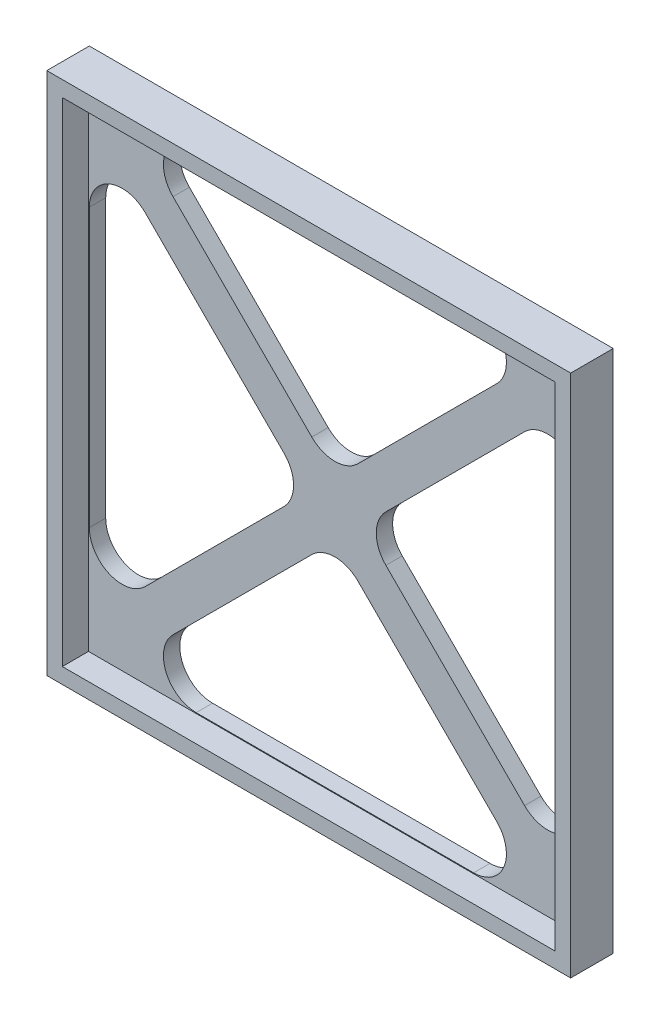
from build123d import *

# Parameters (mm, degrees)
SKETCH2_W           = 160
SKETCH2_H           = 160
BOSS_EXTRUDE1_DEPTH = 5
CUT_EXTRUDE1_REACH  = 115.248
SKETCH3_W           = 150
SKETCH3_H           = 150
BOSS_EXTRUDE2_DEPTH = 5
SKETCH5_W           = 160
SKETCH5_H           = 160
SKETCH5_W_2         = 150.5
SKETCH5_H_2         = 150.5
BOSS_EXTRUDE3_DEPTH = 8
FILLET1_R           = 10


with BuildPart() as part:
    # Sketch2 → Boss-Extrude1 (new body)
    with BuildSketch(Plane.XY):
        Rectangle(SKETCH2_W, SKETCH2_H)
    extrude(amount=BOSS_EXTRUDE1_DEPTH)

    # Sketch3 → Cut-Extrude1 (cut, up to next)
    with BuildSketch(Plane.XY.offset(5), mode=Mode.PRIVATE) as cut_extrude1_sk1:
        Rectangle(SKETCH3_W, SKETCH3_H)
    cut_extrude1_tool1 = extrude(cut_extrude1_sk1.sketch, amount=-CUT_EXTRUDE1_REACH, mode=Mode.PRIVATE) & part.part
    add(cut_extrude1_tool1.solids().sort_by_distance((0, 0, 5))[0], mode=Mode.SUBTRACT)

    # Sketch4 → Boss-Extrude2 (add)
    with BuildSketch(Plane.XY.offset(5)):
        Polygon((66.514718626, 75), (0, 8.485281374), (-66.514718626, 75), (-75, 75), (-75, 66.514718626), (-8.485281374, 0), (-75, -66.514718626), (-75, -75), (-66.514718626, -75), (0, -8.485281374), (66.514718626, -75), (75, -75), (75, -66.514718626), (8.485281374, 0), (75, 66.514718626), (75, 75), align=None)
    extrude(amount=-BOSS_EXTRUDE2_DEPTH)

    # Sketch5 → Boss-Extrude3 (add)
    with BuildSketch(Plane.XY.offset(5)):
        Rectangle(SKETCH5_W, SKETCH5_H)
        Rectangle(SKETCH5_W_2, SKETCH5_H_2, mode=Mode.SUBTRACT)
    extrude(amount=BOSS_EXTRUDE3_DEPTH)

    # Fillet1
    fillet1_edges = [part.edges().sort_by_distance(p)[0] for p in [
        (-66.514718626, 75, 2.5),
        (0, 8.485281374, 2.5),
        (66.514718626, 75, 2.5),
        (75, 66.514718626, 2.5),
        (8.485281374, 0, 2.5),
        (75, -66.514718626, 2.5),
        (66.514718626, -75, 2.5),
        (0, -8.485281374, 2.5),
        (-66.514718626, -75, 2.5),
        (-75, -66.514718626, 2.5),
        (-8.485281374, 0, 2.5),
        (-75, 66.514718626, 2.5),
    ]]
    fillet(fillet1_edges, radius=FILLET1_R)


solid = part.part
